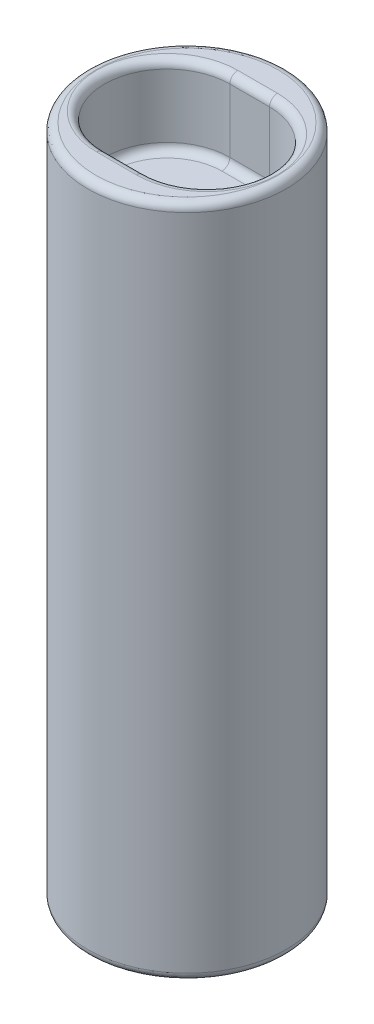
from build123d import *

# Parameters (mm, degrees)
SKETCH1_R           = 6.35
BOSS_EXTRUDE1_DEPTH = 5.08
BOSS_EXTRUDE2_START = 38.1
SKETCH2_R           = 6.35
BOSS_EXTRUDE2_DEPTH = 38.1
FILLET1_R           = 0.508


with BuildPart() as part:
    # Sketch1 → Boss-Extrude1 (new body)
    with BuildSketch(Plane(origin=(0, 0, 0), x_dir=(1, 0, 0), z_dir=(0, 1, 0))):
        with Locations(Location((0, 0, 0), (0, 0, 270))):
            Circle(SKETCH1_R)
        with BuildLine():
            ThreePointArc((-1.27, 4.0132), (-5.2832, 0), (-1.27, -4.0132))
            Line((-1.27, -4.0132), (1.27, -4.0132))
            ThreePointArc((1.27, -4.0132), (5.2832, 0), (1.27, 4.0132))
            Line((1.27, 4.0132), (-1.27, 4.0132))
        make_face(mode=Mode.SUBTRACT)
    extrude(amount=BOSS_EXTRUDE1_DEPTH)

    # Sketch2 → Boss-Extrude2 (add)
    with BuildSketch(Plane.XZ.offset(BOSS_EXTRUDE2_START)):
        with Locations(Location((0, 0, 0), (0, 0, 270))):
            Circle(SKETCH2_R)
    extrude(amount=-BOSS_EXTRUDE2_DEPTH)

    # Fillet1
    fillet1_edges = [part.edges().sort_by_distance(p)[0] for p in [
        (0, 5.08, -4.0132),
        (5.2832, 5.08, 0),
        (0, -38.1, 6.35),
        (0, 5.08, 4.0132),
        (0, 5.08, -6.35),
        (-5.2832, 5.08, 0),
        (0, 0, 4.0132),
        (5.2832, 0, 0),
        (0, 0, -4.0132),
        (-5.2832, 0, 0),
    ]]
    fillet(fillet1_edges, radius=FILLET1_R)


solid = part.part
